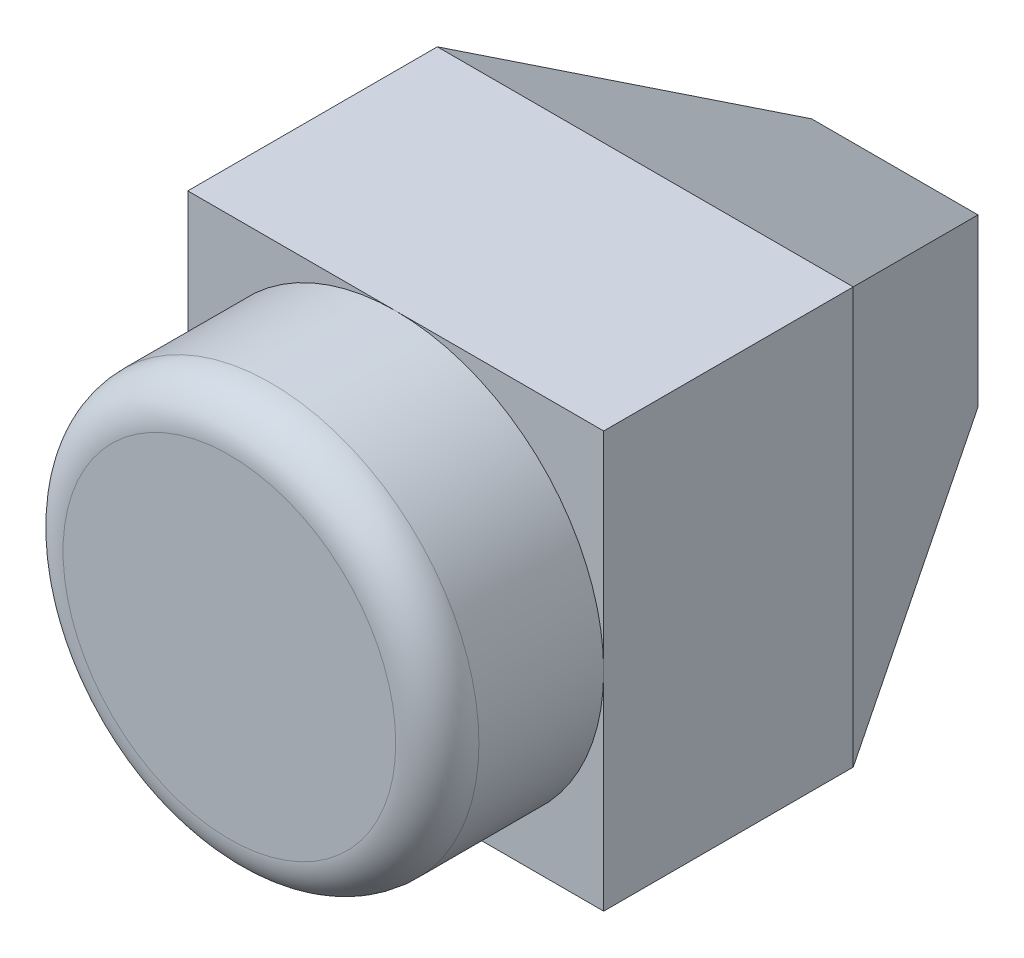
from build123d import *
from OCP.BRepFilletAPI import BRepFilletAPI_MakeChamfer

# Parameters (mm, degrees)
SCHIZZO1_R                   = 5
ESTRUSIONE_ESTRUSIONE1_DEPTH = 4
SCHIZZO2_W                   = 10
SCHIZZO2_H                   = 10
ESTRUSIONE_ESTRUSIONE2_DEPTH = 12
RACCORDO1_R                  = 1
SMUSSO1_SIZE                 = 6
SMUSSO1_SIZE2                = 3


with BuildPart() as part:
    # Schizzo1 → Estrusione-Estrusione1 (new body)
    with BuildSketch(Plane.XY):
        Circle(SCHIZZO1_R)
    extrude(amount=ESTRUSIONE_ESTRUSIONE1_DEPTH)

    # Schizzo2 → Estrusione-Estrusione2 (add)
    with BuildSketch(Plane(origin=(0, 0, 0), x_dir=(-1, 0, 0), z_dir=(0, 0, -1))):
        Rectangle(SCHIZZO2_W, SCHIZZO2_H)
    extrude(amount=ESTRUSIONE_ESTRUSIONE2_DEPTH)

    # Raccordo1
    raccordo1_edges = [part.edges().sort_by_distance(p)[0] for p in [
        (-5, 0, 4),
    ]]
    fillet(raccordo1_edges, radius=RACCORDO1_R)

    # Smusso1: one chamfer whose edges measure the first distance from different faces: ONE call of the kernel's chamfer builder (chamfer() names one face for all edges)
    smusso1_edges_1 = [part.edges().sort_by_distance(p)[0] for p in [
        (0, 5, -12),
    ]]
    smusso1_side_1 = [part.faces().sort_by_distance(p)[0] for p in [
        (0, 5, -6),
    ]]
    smusso1_edges_2 = [part.edges().sort_by_distance(p)[0] for p in [
        (5, 0, -12),
    ]]
    smusso1_side_2 = [part.faces().sort_by_distance(p)[0] for p in [
        (5, 0, -6),
    ]]
    smusso1_edges_3 = [part.edges().sort_by_distance(p)[0] for p in [
        (0, -5, -12),
    ]]
    smusso1_side_3 = [part.faces().sort_by_distance(p)[0] for p in [
        (0, -5, -6),
    ]]
    smusso1_edges_4 = [part.edges().sort_by_distance(p)[0] for p in [
        (-5, 0, -12),
    ]]
    smusso1_side_4 = [part.faces().sort_by_distance(p)[0] for p in [
        (-5, 0, -6),
    ]]
    smusso1 = BRepFilletAPI_MakeChamfer(part.part.solid().wrapped)
    for e in smusso1_edges_1:
        smusso1.Add(SMUSSO1_SIZE, SMUSSO1_SIZE2, e.wrapped, smusso1_side_1[0].wrapped)  # the first distance lies on this face
    for e in smusso1_edges_2:
        smusso1.Add(SMUSSO1_SIZE, SMUSSO1_SIZE2, e.wrapped, smusso1_side_2[0].wrapped)  # the first distance lies on this face
    for e in smusso1_edges_3:
        smusso1.Add(SMUSSO1_SIZE, SMUSSO1_SIZE2, e.wrapped, smusso1_side_3[0].wrapped)  # the first distance lies on this face
    for e in smusso1_edges_4:
        smusso1.Add(SMUSSO1_SIZE, SMUSSO1_SIZE2, e.wrapped, smusso1_side_4[0].wrapped)  # the first distance lies on this face
    add(Compound.cast(smusso1.Shape()), mode=Mode.REPLACE)


solid = part.part
